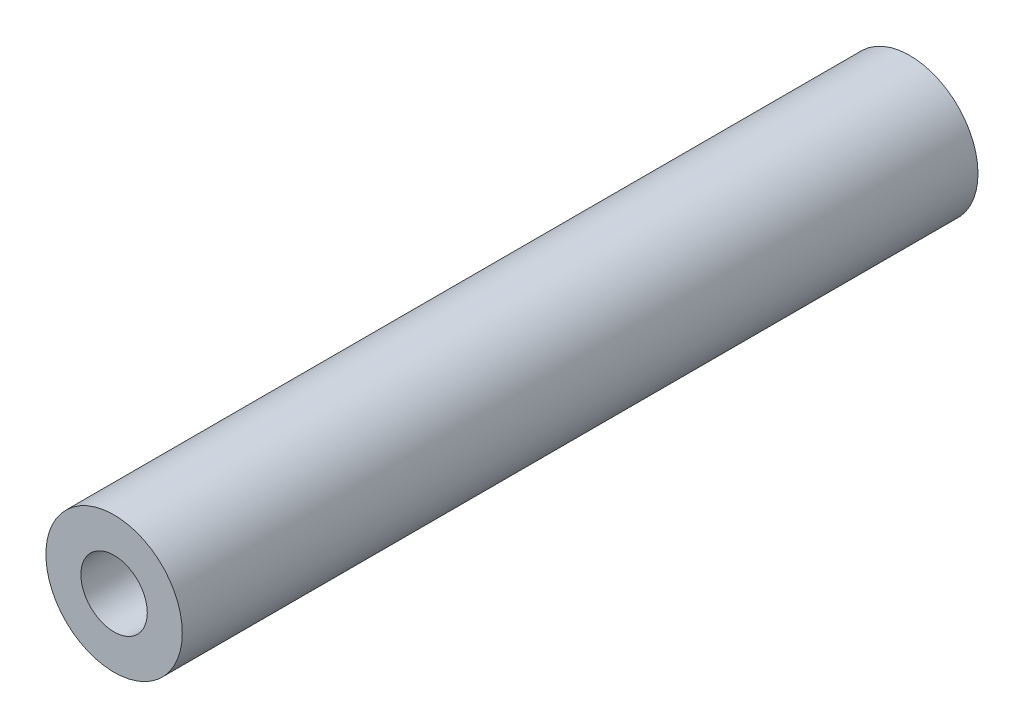
from build123d import *

# Parameters (mm, degrees)
SKETCH1_R           = 6
BOSS_EXTRUDE1_DEPTH = 35
SKETCH2_R           = 2.921
CUT_EXTRUDE1_DEPTH  = 25.4
FILLET1_R           = 2.5


with BuildPart() as part:
    # Sketch1 → Boss-Extrude1 (new, symmetric)
    with BuildSketch(Plane.XY):
        Circle(SKETCH1_R)
    extrude(amount=BOSS_EXTRUDE1_DEPTH, both=True)

    # Sketch2 → Cut-Extrude1 (cut)
    with BuildSketch(Plane.XY.offset(35)):
        Circle(SKETCH2_R)
    cut_extrude1 = extrude(amount=-CUT_EXTRUDE1_DEPTH, mode=Mode.SUBTRACT)

    # Mirror1: Cut-Extrude1 across plane
    add(cut_extrude1.mirror(Plane.XY), mode=Mode.SUBTRACT)

    # Fillet1
    fillet1_edges = [part.edges().sort_by_distance(p)[0] for p in [
        (-2.921, 0, -9.6),
        (-2.921, 0, 9.6),
    ]]
    fillet(fillet1_edges, radius=FILLET1_R)


solid = part.part
